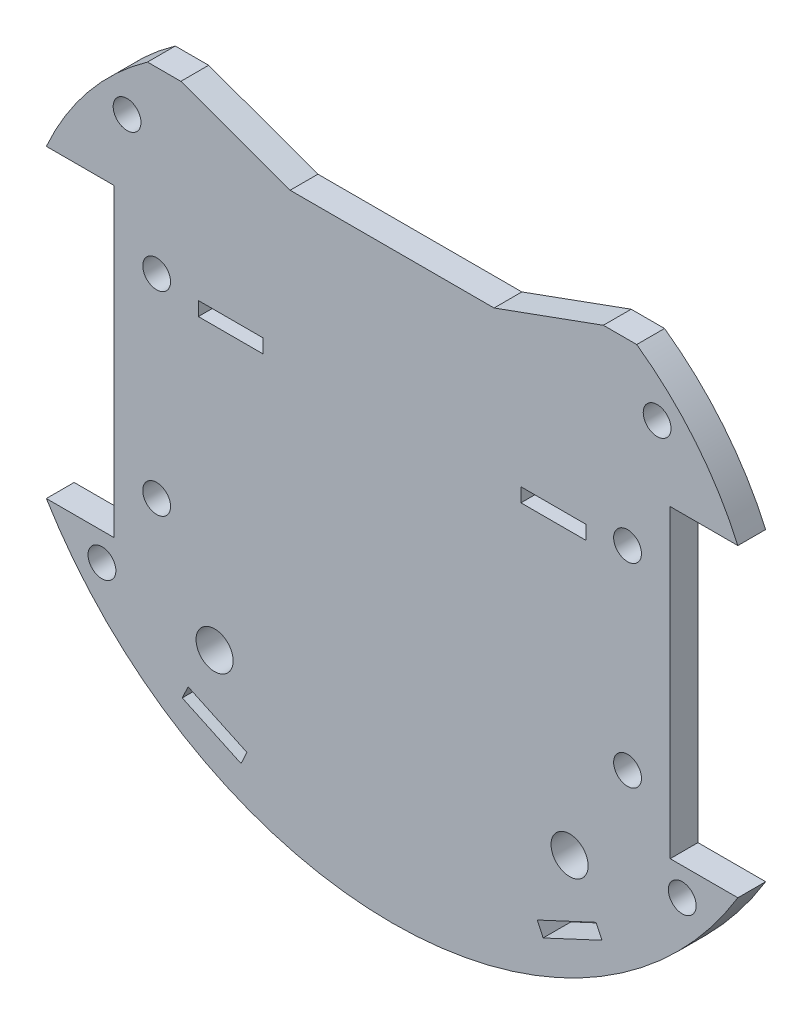
from build123d import *

# Parameters (mm, degrees)
BOSS_EXTRUDE1_DEPTH = 3
SKETCH2_R           = 1.5
CUT_EXTRUDE3_DEPTH  = 3
CUT_EXTRUDE4_START  = -10
CUT_EXTRUDE4_DEPTH  = 10
BOSS_EXTRUDE2_START = -3
BOSS_EXTRUDE2_DEPTH = 3
SKETCH5_W           = 0.56
SKETCH5_H           = 32.898596714
CUT_EXTRUDE5_DEPTH  = 3
SKETCH6_W           = 0.2
SKETCH6_H           = 32.898596714
CUT_EXTRUDE6_DEPTH  = 3
SKETCH7_R           = 2
CUT_EXTRUDE8_DEPTH  = 3
BOSS_EXTRUDE3_START = -3
BOSS_EXTRUDE3_DEPTH = 3
CUT_EXTRUDE9_START  = -3
CUT_EXTRUDE9_DEPTH  = 3
BOSS_EXTRUDE5_START = -3
BOSS_EXTRUDE5_DEPTH = 3
SKETCH11_R          = 1.5
CUT_EXTRUDE10_DEPTH = 3
CUT_EXTRUDE11_DEPTH = 3
SKETCH13_W          = 7
SKETCH13_H          = 1.5
CUT_EXTRUDE12_DEPTH = 3
SKETCH14_R          = 1.5
CUT_EXTRUDE13_DEPTH = 3


with BuildPart() as part:
    # Sketch1 → Boss-Extrude1 (new body)
    with BuildSketch(Plane.XY):
        with BuildLine():
            Line((-11, 25.5), (-22.790038711, 29.780264196))
            ThreePointArc((-22.790038711, 29.780264196), (0, -37.5), (22.790038711, 29.780264196))
            Line((22.790038711, 29.780264196), (11, 25.5))
            Line((11, 25.5), (-11, 25.5))
        make_face()
    extrude(amount=BOSS_EXTRUDE1_DEPTH)

    # Sketch2 → Cut-Extrude3 (cut)
    with BuildSketch(Plane.XY.offset(3)):
        with Locations((-25.400000001, 10.496905453)):
            Circle(SKETCH2_R)
        with Locations((-25.399981845, -10.493094547)):
            Circle(SKETCH2_R)
        with Locations(Location((25.399981845, -10.493094547, 0), (0, 0, 180))):
            Circle(SKETCH2_R)
        with Locations(Location((25.400000001, 10.496905453, 0), (0, 0, 180))):
            Circle(SKETCH2_R)
    extrude(amount=-CUT_EXTRUDE3_DEPTH, mode=Mode.SUBTRACT)

    # Sketch3 → Cut-Extrude4 (cut)
    with BuildSketch(Plane.XY.offset(3).offset(CUT_EXTRUDE4_START)):
        with BuildLine():
            Line((-30.76, 21.449298357), (-30.76, -21.449298357))
            ThreePointArc((-30.76, -21.449298357), (-37.5, 0), (-30.76, 21.449298357))
        make_face()
        with BuildLine():
            Line((30.76, 21.449298357), (30.76, -21.449298357))
            ThreePointArc((30.76, -21.449298357), (37.5, 0), (30.76, 21.449298357))
        make_face()
    extrude(amount=CUT_EXTRUDE4_DEPTH, mode=Mode.SUBTRACT)

    # Sketch4 → Boss-Extrude2 (add)
    with BuildSketch(Plane.XY.offset(3).offset(BOSS_EXTRUDE2_START)):
        with BuildLine():
            Line((-30.76, -21.449298357), (-30.76, -16.449298357))
            Line((-30.76, -16.449298357), (-33.699711921, -16.449298357))
            ThreePointArc((-33.699711921, -16.449298357), (-32.32667034, -19.006219634), (-30.76, -21.449298357))
        make_face()
        with BuildLine():
            Line((-33.699711921, 16.449298357), (-30.76, 16.449298357))
            Line((-30.76, 16.449298357), (-30.76, 21.449298357))
            ThreePointArc((-30.76, 21.449298357), (-32.32667034, 19.006219634), (-33.699711921, 16.449298357))
        make_face()
        with BuildLine():
            Line((30.76, 21.449298357), (30.76, 16.449298357))
            Line((30.76, 16.449298357), (33.699711921, 16.449298357))
            ThreePointArc((33.699711921, 16.449298357), (32.32667034, 19.006219634), (30.76, 21.449298357))
        make_face()
        with BuildLine():
            Line((30.76, -16.449298357), (30.76, -21.449298357))
            ThreePointArc((30.76, -21.449298357), (32.32667034, -19.006219634), (33.699711921, -16.449298357))
            Line((33.699711921, -16.449298357), (30.76, -16.449298357))
        make_face()
    extrude(amount=BOSS_EXTRUDE2_DEPTH)

    # Sketch5 → Cut-Extrude5 (cut)
    with BuildSketch(Plane.XY.offset(3)):
        with Locations((-30.48, 0)):
            Rectangle(SKETCH5_W, SKETCH5_H)
        with Locations((30.48, 0)):
            Rectangle(SKETCH5_W, SKETCH5_H)
    extrude(amount=-CUT_EXTRUDE5_DEPTH, mode=Mode.SUBTRACT)

    # Sketch6 → Cut-Extrude6 (cut)
    with BuildSketch(Plane.XY.offset(3)):
        with Locations((-30.1, 0)):
            Rectangle(SKETCH6_W, SKETCH6_H)
        with Locations((30.1, 0)):
            Rectangle(SKETCH6_W, SKETCH6_H)
    extrude(amount=-CUT_EXTRUDE6_DEPTH, mode=Mode.SUBTRACT)

    # Sketch7 → Cut-Extrude8 (cut)
    with BuildSketch(Plane.XY.offset(3)):
        with Locations((-19.15, -21.55)):
            Circle(SKETCH7_R)
        with Locations(Location((19.15, -21.55, 0), (0, 0, 180))):
            Circle(SKETCH7_R)
    extrude(amount=-CUT_EXTRUDE8_DEPTH, mode=Mode.SUBTRACT)

    # Sketch8 → Boss-Extrude3 (add)
    with BuildSketch(Plane.XY.offset(3).offset(BOSS_EXTRUDE3_START)):
        with BuildLine():
            Line((-33.699711921, 16.449298357), (-37.299711921, 16.449298357))
            ThreePointArc((-37.299711921, 16.449298357), (-32.744884003, 23.851322108), (-26.390038711, 29.780264196))
            Line((-26.390038711, 29.780264196), (-22.790038711, 29.780264196))
            ThreePointArc((-22.790038711, 29.780264196), (-29.020710607, 23.749702226), (-33.699711921, 16.449298357))
        make_face()
        with BuildLine():
            Line((33.699711921, 16.449298357), (37.299711921, 16.449298357))
            ThreePointArc((37.299711921, 16.449298357), (32.744884003, 23.851322108), (26.390038711, 29.780264196))
            Line((26.390038711, 29.780264196), (22.790038711, 29.780264196))
            ThreePointArc((22.790038711, 29.780264196), (29.020710607, 23.749702226), (33.699711921, 16.449298357))
        make_face()
    extrude(amount=BOSS_EXTRUDE3_DEPTH)

    # Sketch9 → Cut-Extrude9 (cut)
    with BuildSketch(Plane.XY.offset(3).offset(CUT_EXTRUDE9_START)):
        with BuildLine():
            Line((4.733920151, -37.2), (-4.733920151, -37.2))
            ThreePointArc((-4.733920151, -37.2), (0, -37.5), (4.733920151, -37.2))
        make_face()
    extrude(amount=CUT_EXTRUDE9_DEPTH, mode=Mode.SUBTRACT)

    # Sketch10 → Boss-Extrude5 (add)
    with BuildSketch(Plane.XY.offset(3).offset(BOSS_EXTRUDE5_START)):
        with BuildLine():
            ThreePointArc((-4.733920151, -37.2), (-21.838816892, -30.484685938), (-33.699711921, -16.449298357))
            Line((-33.699711921, -16.449298357), (-37.299711921, -16.449298357))
            ThreePointArc((-37.299711921, -16.449298357), (-23.43831182, -30.624902723), (-4.733920151, -37.2))
        make_face()
        with BuildLine():
            ThreePointArc((33.699711921, -16.449298357), (21.838816892, -30.484685938), (4.733920151, -37.2))
            ThreePointArc((4.733920151, -37.2), (23.43831182, -30.624902723), (37.299711921, -16.449298357))
            Line((37.299711921, -16.449298357), (33.699711921, -16.449298357))
        make_face()
        with BuildLine():
            Line((4.733920151, -37.2), (-4.733920151, -37.2))
            ThreePointArc((-4.733920151, -37.2), (0, -37.457659609), (4.733920151, -37.2))
        make_face()
    extrude(amount=BOSS_EXTRUDE5_DEPTH)

    # Sketch11 → Cut-Extrude10 (cut)
    with BuildSketch(Plane.XY.offset(3)):
        with Locations((-28.590038711, 23.780264196)):
            Circle(SKETCH11_R)
        with Locations(Location((28.590038711, 23.780264196, 0), (0, 0, 180))):
            Circle(SKETCH11_R)
    extrude(amount=-CUT_EXTRUDE10_DEPTH, mode=Mode.SUBTRACT)

    # Sketch12 → Cut-Extrude11 (cut)
    with BuildSketch(Plane.XY.offset(3)):
        Polygon((-22.005113558, -26.391105244), (-15.660959049, -29.349433076), (-16.294886442, -30.708894756), (-22.639040951, -27.750566924), align=None)
        Polygon((22.005113558, -26.391105244), (15.660959049, -29.349433076), (16.294886442, -30.708894756), (22.639040951, -27.750566924), align=None)
    extrude(amount=-CUT_EXTRUDE11_DEPTH, mode=Mode.SUBTRACT)

    # Sketch13 → Cut-Extrude12 (cut)
    with BuildSketch(Plane.XY.offset(3)):
        with Locations((-17.400000001, 9.496905453)):
            Rectangle(SKETCH13_W, SKETCH13_H)
        with Locations((17.400000001, 9.496905453)):
            Rectangle(SKETCH13_W, SKETCH13_H)
    extrude(amount=-CUT_EXTRUDE12_DEPTH, mode=Mode.SUBTRACT)

    # Sketch14 → Cut-Extrude13 (cut)
    with BuildSketch(Plane.XY.offset(3)):
        with Locations((-31.299711921, -19.449298357)):
            Circle(SKETCH14_R)
        with Locations((31.299711921, -19.449298357)):
            Circle(SKETCH14_R)
    extrude(amount=-CUT_EXTRUDE13_DEPTH, mode=Mode.SUBTRACT)


solid = part.part
